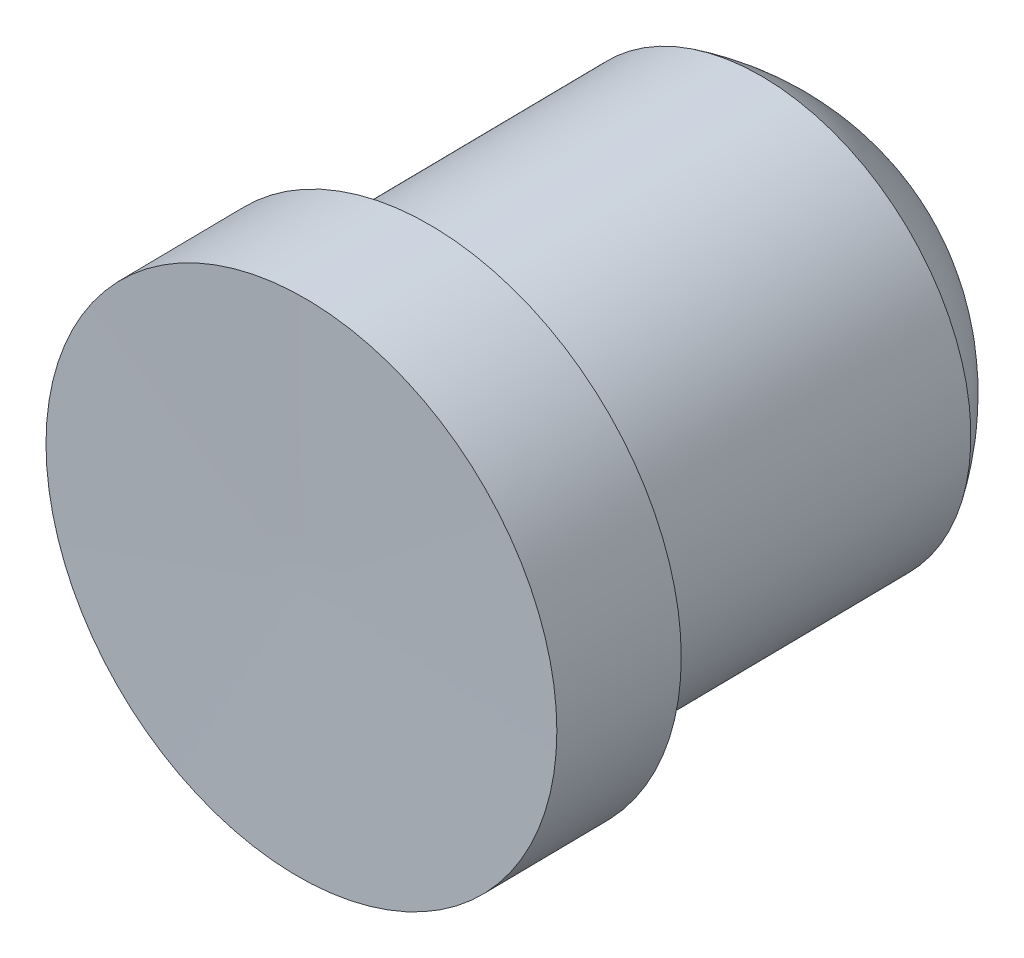
from build123d import *


with BuildPart() as part:
    # Sketch3 → Revolve1 (revolve)
    with BuildSketch(Plane(origin=(0, 0, 0), x_dir=(1, 0, 0), z_dir=(0, 1, 0)), mode=Mode.PRIVATE) as revolve1_sk:
        with BuildLine():
            Line((2.815016612, 28.046299004), (5.815297296, 28.044955469))
            Line((5.815297296, 28.044955469), (5.795438607, 29.544964512))
            Line((5.795438607, 29.544964512), (5.295391827, 29.545188435))
            Line((5.295391827, 29.545188435), (5.242440283, 33.544837936))
            ThreePointArc((5.242440283, 33.544837936), (4.151137578, 34.556580072), (2.723276154, 34.97583596))
            Line((2.723276154, 34.97583596), (2.815016612, 28.046299004))
        make_face()
    revolve(revolve1_sk.sketch.rotate(Axis((2.674750353, 0, -38.641190812), (0.013237885798534722, 0, 0.999912375350753)), 180), axis=Axis((2.674750353, 0, -38.641190812), (0.013237885798534722, 0, 0.999912375350753)))


solid = part.part
